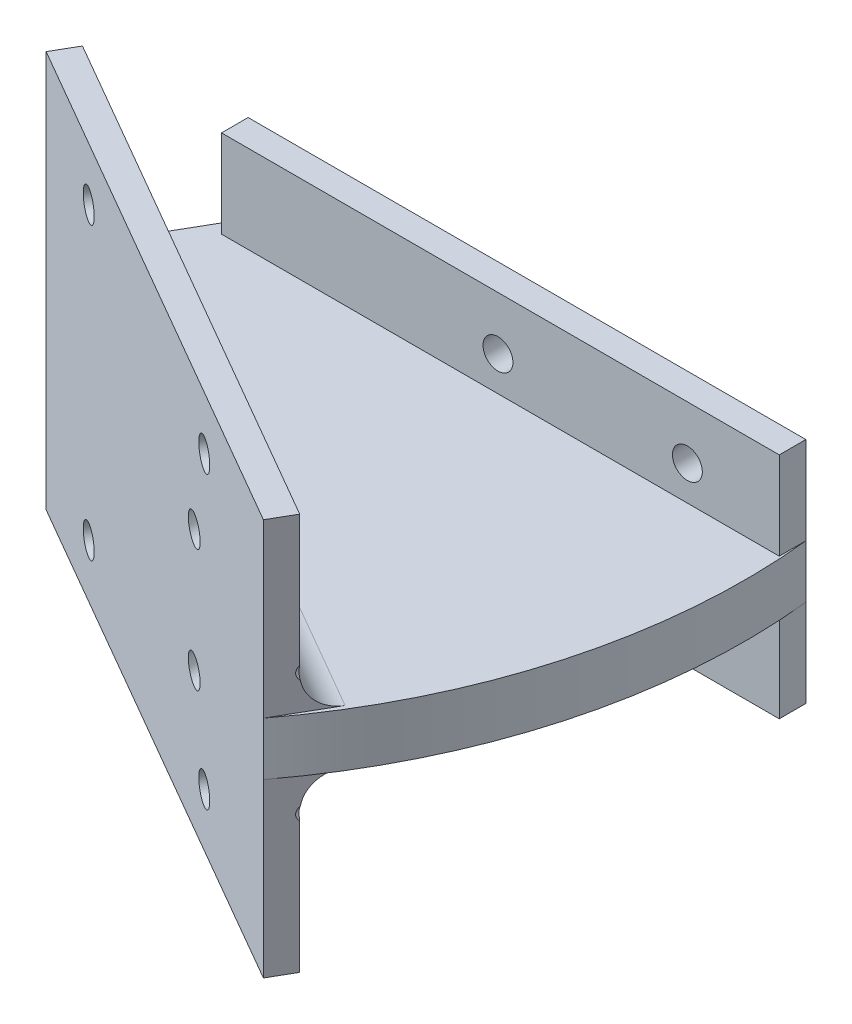
from build123d import *

# Parameters (mm, degrees)
BOSS_EXTRUDE1_DEPTH      = 4
BOSS_EXTRUDE1_DEPTH_BACK = 4
SKETCH3_W                = 89.310018428
SKETCH3_H                = 59.716622104
BOSS_EXTRUDE2_DEPTH      = 4
CUT_EXTRUDE1_REACH       = 112.584
SKETCH4_R                = 2.25
SKETCH5_W                = 83.9215243
SKETCH5_H                = 34.4
BOSS_EXTRUDE3_DEPTH      = 4
SKETCH6_R                = 2.25
CUT_EXTRUDE2_DEPTH       = 4
FILLET1_R                = 5
SKETCH7_R                = 2.1
CUT_EXTRUDE3_DEPTH       = 109.665502377


with BuildPart() as part:
    # Sketch2 → Boss-Extrude1 (new, two sides: drawn at the far end of the back side and taken through both)
    with BuildSketch(Plane(origin=(0, 0, 0), x_dir=(1, 0, 0), z_dir=(0, 1, 0)).offset(-BOSS_EXTRUDE1_DEPTH_BACK)):
        with BuildLine():
            Line((1.154700538, 0), (85.076224838, 0))
            ThreePointArc((85.076224838, 0), (82.329376533, -33.6502282), (67.376468713, -63.920569811))
            Line((67.376468713, -63.920569811), (-9.968276059, -19.265560597))
            Line((-9.968276059, -19.265560597), (1.154700538, 0))
        make_face()
    extrude(amount=BOSS_EXTRUDE1_DEPTH + BOSS_EXTRUDE1_DEPTH_BACK)

    # Sketch3 → Boss-Extrude2 (add)
    with BuildSketch(Plane(origin=(-10.834301462, 0, 18.765560597), x_dir=(0.8660254037844386, 0, 0.5000000000000001), z_dir=(-0.5000000000000001, 0, 0.8660254037844386))):
        with Locations((45.655009214, 0)):
            Rectangle(SKETCH3_W, SKETCH3_H)
    extrude(amount=-BOSS_EXTRUDE2_DEPTH)

    # Sketch4 → Cut-Extrude1 (cut, up to next)
    with BuildSketch(Plane(origin=(-10.834301462, 0, 18.765560597), x_dir=(0.8660254037844386, 0, 0.5000000000000001), z_dir=(-0.5000000000000001, 0, 0.8660254037844386)), mode=Mode.PRIVATE) as cut_extrude1_sk1:
        with Locations((66, 21.858311052)):
            Circle(SKETCH4_R)
    cut_extrude1_tool1 = extrude(cut_extrude1_sk1.sketch, amount=-CUT_EXTRUDE1_REACH, mode=Mode.PRIVATE) & part.part
    # Sketch4 → Cut-Extrude1 (cut, up to next)
    with BuildSketch(Plane(origin=(-10.834301462, 0, 18.765560597), x_dir=(0.8660254037844386, 0, 0.5000000000000001), z_dir=(-0.5000000000000001, 0, 0.8660254037844386)), mode=Mode.PRIVATE) as cut_extrude1_sk2:
        with Locations((66, -21.858311052)):
            Circle(SKETCH4_R)
    cut_extrude1_tool2 = extrude(cut_extrude1_sk2.sketch, amount=-CUT_EXTRUDE1_REACH, mode=Mode.PRIVATE) & part.part
    # Sketch4 → Cut-Extrude1 (cut, up to next)
    with BuildSketch(Plane(origin=(-10.834301462, 0, 18.765560597), x_dir=(0.8660254037844386, 0, 0.5000000000000001), z_dir=(-0.5000000000000001, 0, 0.8660254037844386)), mode=Mode.PRIVATE) as cut_extrude1_sk3:
        with Locations((18.5, 21.858311052)):
            Circle(SKETCH4_R)
    cut_extrude1_tool3 = extrude(cut_extrude1_sk3.sketch, amount=-CUT_EXTRUDE1_REACH, mode=Mode.PRIVATE) & part.part
    # Sketch4 → Cut-Extrude1 (cut, up to next)
    with BuildSketch(Plane(origin=(-10.834301462, 0, 18.765560597), x_dir=(0.8660254037844386, 0, 0.5000000000000001), z_dir=(-0.5000000000000001, 0, 0.8660254037844386)), mode=Mode.PRIVATE) as cut_extrude1_sk4:
        with Locations((18.5, -21.858311052)):
            Circle(SKETCH4_R)
    cut_extrude1_tool4 = extrude(cut_extrude1_sk4.sketch, amount=-CUT_EXTRUDE1_REACH, mode=Mode.PRIVATE) & part.part
    add(cut_extrude1_tool1.solids().sort_by_distance((46.323375, 21.858311, 51.765561))[0], mode=Mode.SUBTRACT)
    add(cut_extrude1_tool2.solids().sort_by_distance((46.323375, -21.858311, 51.765561))[0], mode=Mode.SUBTRACT)
    add(cut_extrude1_tool3.solids().sort_by_distance((5.187169, 21.858311, 28.015561))[0], mode=Mode.SUBTRACT)
    add(cut_extrude1_tool4.solids().sort_by_distance((5.187169, -21.858311, 28.015561))[0], mode=Mode.SUBTRACT)

    # Sketch5 → Boss-Extrude3 (add)
    with BuildSketch(Plane(origin=(0, 0, 0), x_dir=(-1, 0, 0), z_dir=(0, 0, -1))):
        with Locations((-43.115462688, 0)):
            Rectangle(SKETCH5_W, SKETCH5_H)
    extrude(amount=-BOSS_EXTRUDE3_DEPTH)

    # Sketch6 → Cut-Extrude2 (cut)
    with BuildSketch(Plane(origin=(0, 0, 0), x_dir=(-1, 0, 0), z_dir=(0, 0, -1))):
        with Locations((-71.25, -9.2)):
            Circle(SKETCH6_R)
        with Locations((-71.25, 9.2)):
            Circle(SKETCH6_R)
        with Locations((-42.75, 9.2)):
            Circle(SKETCH6_R)
        with Locations((-42.75, -9.2)):
            Circle(SKETCH6_R)
    extrude(amount=-CUT_EXTRUDE2_DEPTH, mode=Mode.SUBTRACT)

    # Fillet1
    fillet1_edges = [part.edges().sort_by_distance(p)[0] for p in [
        (30.704096327, -4, 38.128963589),
        (30.704096327, 4, 38.128963589),
    ]]
    fillet(fillet1_edges, radius=FILLET1_R)

    # Sketch7 → Cut-Extrude3 (cut, through all)
    with BuildSketch(Plane.XY.offset(4)):
        with Locations((42.75, 9.2)):
            Circle(SKETCH7_R)
        with Locations((71.25, 9.2)):
            Circle(SKETCH7_R)
    cut_extrude3 = extrude(amount=CUT_EXTRUDE3_DEPTH, mode=Mode.SUBTRACT)

    # Mirror1: Cut-Extrude3 across plane
    add(cut_extrude3.mirror(Plane.ZX), mode=Mode.SUBTRACT)


solid = part.part
